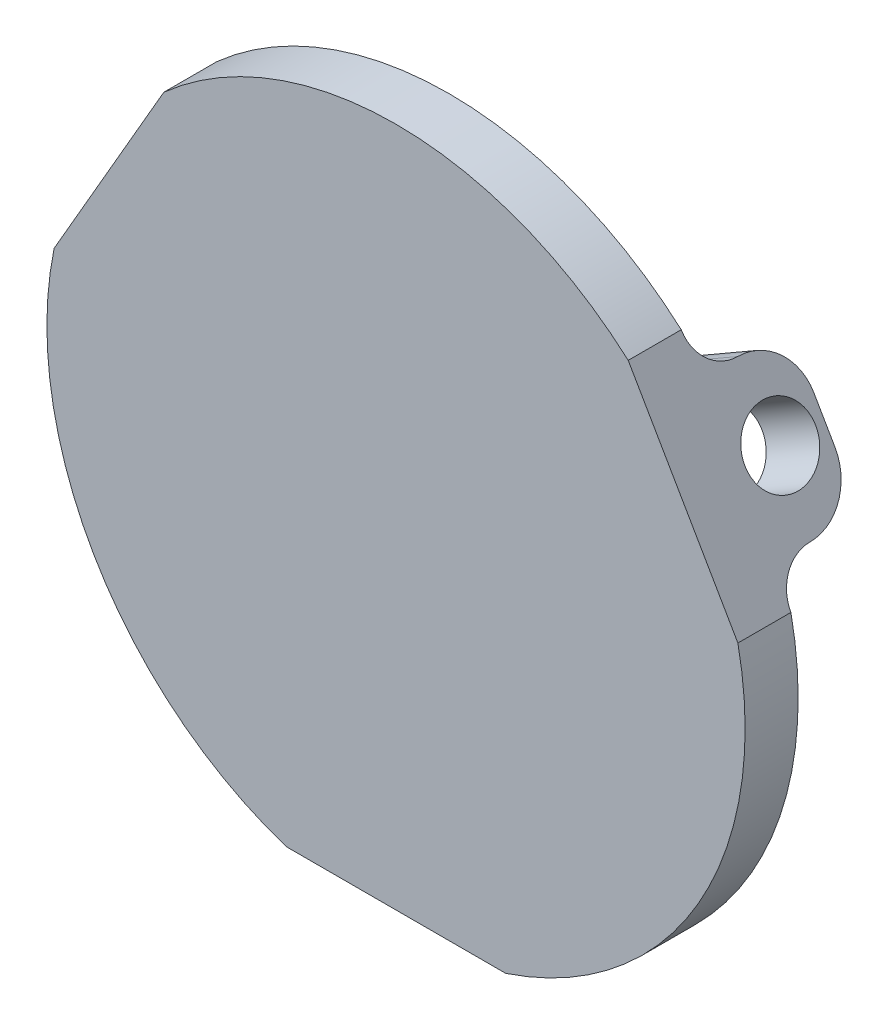
from build123d import *

# Parameters (mm, degrees)
SKETCH2_R                   = 79
BOSS_EXTRUDE1_DEPTH         = 12
SKETCH2_3_W                 = 49.638694584
SKETCH2_3_H                 = 14
CUT_EXTRUDE1_DEPTH          = 113.365475125
SKETCH2_4_W                 = 49.638694584
SKETCH2_4_H                 = 14
BOSS_EXTRUDE2_DEPTH         = 20
SKETCH3_R                   = 8
CUT_EXTRUDE2_DEPTH          = 175.232603149
CIRPATTERN1_COUNT           = 3
CIRPATTERN1_COPY_1_SKETCH_R = 8
CIRPATTERN1_COPY_1_DEPTH    = 175.232603149
CIRPATTERN1_COPY_2_SKETCH_R = 8
CIRPATTERN1_COPY_2_DEPTH    = 175.232603149


with BuildPart() as part:
    # Sketch2 → Boss-Extrude1 (new body)
    with BuildSketch(Plane.XY):
        Circle(SKETCH2_R)
    extrude(amount=BOSS_EXTRUDE1_DEPTH)

    # Sketch2<3> → Cut-Extrude1 (cut, symmetric)
    with BuildSketch(Plane.XY):
        with Locations((0, -82)):
            Rectangle(SKETCH2_3_W, SKETCH2_3_H)
    cut_extrude1 = extrude(amount=CUT_EXTRUDE1_DEPTH, both=True, mode=Mode.SUBTRACT)

    # Sketch2<4> → Boss-Extrude2 (add)
    with BuildSketch(Plane.XY):
        with Locations((0, -68)):
            Rectangle(SKETCH2_4_W, SKETCH2_4_H)
    boss_extrude2 = extrude(amount=-BOSS_EXTRUDE2_DEPTH)

    # Sketch3 → Cut-Extrude2 (cut, symmetric)
    with BuildSketch(Plane.XZ.offset(75)):
        with Locations(Location((0, -10, 0), (0, 0, 270))):
            Circle(SKETCH3_R)
        with BuildLine():
            Line((-24.819347292, 0), (-24.819347292, -20))
            Line((-24.819347292, -20), (-4.819347292, -20))
            ThreePointArc((-4.819347292, -20), (-12.938662868, -16.636869371), (-16.301793497, -8.517553795))
            ThreePointArc((-16.301793497, -8.517553795), (-18.796527244, -2.494733747), (-24.819347292, 0))
        make_face()
    cut_extrude2 = extrude(amount=CUT_EXTRUDE2_DEPTH, both=True, mode=Mode.SUBTRACT)

    # Mirror1: Cut-Extrude2 across plane
    add(cut_extrude2.mirror(Plane(origin=(0, 0, 0), x_dir=(0, 0, 1), z_dir=(1, 0, 0))), mode=Mode.SUBTRACT)

    # CirPattern1: Cut-Extrude1, Boss-Extrude2, Cut-Extrude2 ×3 about axis
    cirpattern1_axis = Axis((0, 0, 0), (0, 0, 1))
    add([cut_extrude1.rotate(cirpattern1_axis, i * 360 / CIRPATTERN1_COUNT) for i in range(1, CIRPATTERN1_COUNT)], mode=Mode.SUBTRACT)
    add([boss_extrude2.rotate(cirpattern1_axis, i * 360 / CIRPATTERN1_COUNT) for i in range(1, CIRPATTERN1_COUNT)])
    add([cut_extrude2.rotate(cirpattern1_axis, i * 360 / CIRPATTERN1_COUNT) for i in range(1, CIRPATTERN1_COUNT)], mode=Mode.SUBTRACT)

    # CirPattern1 copy 1 sketch → CirPattern1 copy 1 (cut, symmetric)
    with BuildSketch(Plane(origin=(64.951905284, 37.5, 0), x_dir=(0.4999999999999998, -0.8660254037844387, 0), z_dir=(0.8660254037844387, 0.4999999999999998, 0))):
        with Locations((0, 10)):
            Circle(CIRPATTERN1_COPY_1_SKETCH_R)
        with BuildLine():
            Line((-24.819347292, 0), (-24.819347292, 20))
            Line((-24.819347292, 20), (-4.819347292, 20))
            ThreePointArc((-4.819347292, 20), (-12.938662868, 16.636869371), (-16.301793497, 8.517553795))
            ThreePointArc((-16.301793497, 8.517553795), (-18.796527244, 2.494733747), (-24.819347292, 0))
        make_face()
    extrude(amount=CIRPATTERN1_COPY_1_DEPTH, both=True, mode=Mode.SUBTRACT)

    # CirPattern1 copy 2 sketch → CirPattern1 copy 2 (cut, symmetric)
    with BuildSketch(Plane(origin=(-64.951905284, 37.5, 0), x_dir=(0.5000000000000004, 0.8660254037844384, 0), z_dir=(-0.8660254037844384, 0.5000000000000004, 0))):
        with Locations((0, 10)):
            Circle(CIRPATTERN1_COPY_2_SKETCH_R)
        with BuildLine():
            Line((-24.819347292, 0), (-24.819347292, 20))
            Line((-24.819347292, 20), (-4.819347292, 20))
            ThreePointArc((-4.819347292, 20), (-12.938662868, 16.636869371), (-16.301793497, 8.517553795))
            ThreePointArc((-16.301793497, 8.517553795), (-18.796527244, 2.494733747), (-24.819347292, 0))
        make_face()
    extrude(amount=CIRPATTERN1_COPY_2_DEPTH, both=True, mode=Mode.SUBTRACT)


with BuildPart() as part_1:
    # Body-Move/Copy1: moved
    add(part.part.moved(Location((0, -5e-08, 10))))


solid = part_1.part
